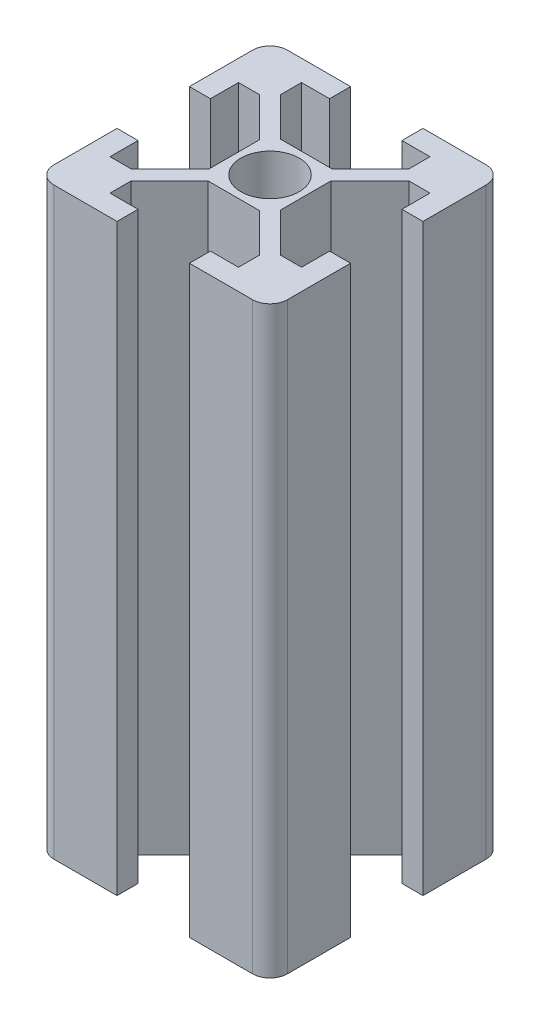
from build123d import *

# Parameters (mm, degrees)
SKETCH_1_R      = 2.5
EXTRUDE_1_DEPTH = 50


with BuildPart() as part:
    # 草图1 → 凸台-拉伸1 (new body)
    with BuildSketch(Plane(origin=(0, 0, 0), x_dir=(1, 0, 0), z_dir=(0, 1, 0))):
        with BuildLine():
            Line((-46.447412537, 7.805888715), (-48.247412537, 7.805888715))
            Line((-48.247412537, 7.805888715), (-48.247412537, 2.405888715))
            ThreePointArc((-48.247412537, 2.405888715), (-47.808072709, 1.345228544), (-46.747412537, 0.905888715))
            Line((-46.747412537, 0.905888715), (-41.347412537, 0.905888715))
            Line((-41.347412537, 0.905888715), (-41.347412537, 2.705888715))
            Line((-41.347412537, 2.705888715), (-43.747412537, 2.705888715))
            Line((-43.747412537, 2.705888715), (-43.747412537, 4.50883856))
            Line((-43.747412537, 4.50883856), (-40.450362382, 7.805888715))
            Line((-40.450362382, 7.805888715), (-36.044462693, 7.805888715))
            Line((-36.044462693, 7.805888715), (-32.747412537, 4.50883856))
            Line((-32.747412537, 4.50883856), (-32.747412537, 2.705888715))
            Line((-32.747412537, 2.705888715), (-35.147412537, 2.705888715))
            Line((-35.147412537, 2.705888715), (-35.147412537, 0.905888715))
            Line((-35.147412537, 0.905888715), (-29.747412537, 0.905888715))
            ThreePointArc((-29.747412537, 0.905888715), (-28.686752366, 1.345228544), (-28.247412537, 2.405888715))
            Line((-28.247412537, 2.405888715), (-28.247412537, 7.805888715))
            Line((-28.247412537, 7.805888715), (-30.047412537, 7.805888715))
            Line((-30.047412537, 7.805888715), (-30.047412537, 5.405888715))
            Line((-30.047412537, 5.405888715), (-31.850362382, 5.405888715))
            Line((-31.850362382, 5.405888715), (-35.193285517, 8.74881185))
            Line((-35.193285517, 8.74881185), (-35.193285517, 13.062965581))
            Line((-35.193285517, 13.062965581), (-31.850362382, 16.405888715))
            Line((-31.850362382, 16.405888715), (-30.047412537, 16.405888715))
            Line((-30.047412537, 16.405888715), (-30.047412537, 14.005888715))
            Line((-30.047412537, 14.005888715), (-28.247412537, 14.005888715))
            Line((-28.247412537, 14.005888715), (-28.247412537, 19.405888715))
            ThreePointArc((-28.247412537, 19.405888715), (-28.686752366, 20.466548887), (-29.747412537, 20.905888715))
            Line((-29.747412537, 20.905888715), (-35.147412537, 20.905888715))
            Line((-35.147412537, 20.905888715), (-35.147412537, 19.105888715))
            Line((-35.147412537, 19.105888715), (-32.747412537, 19.105888715))
            Line((-32.747412537, 19.105888715), (-32.747412537, 17.302938871))
            Line((-32.747412537, 17.302938871), (-36.044462693, 14.005888715))
            Line((-36.044462693, 14.005888715), (-40.450362382, 14.005888715))
            Line((-40.450362382, 14.005888715), (-43.747412537, 17.302938871))
            Line((-43.747412537, 17.302938871), (-43.747412537, 19.105888715))
            Line((-43.747412537, 19.105888715), (-41.347412537, 19.105888715))
            Line((-41.347412537, 19.105888715), (-41.347412537, 20.905888715))
            Line((-41.347412537, 20.905888715), (-46.747412537, 20.905888715))
            ThreePointArc((-46.747412537, 20.905888715), (-47.808072709, 20.466548887), (-48.247412537, 19.405888715))
            Line((-48.247412537, 19.405888715), (-48.247412537, 14.005888715))
            Line((-48.247412537, 14.005888715), (-46.447412537, 14.005888715))
            Line((-46.447412537, 14.005888715), (-46.447412537, 16.405888715))
            Line((-46.447412537, 16.405888715), (-44.644462693, 16.405888715))
            Line((-44.644462693, 16.405888715), (-41.301539558, 13.062965581))
            Line((-41.301539558, 13.062965581), (-41.301539558, 8.74881185))
            Line((-41.301539558, 8.74881185), (-44.644462693, 5.405888715))
            Line((-44.644462693, 5.405888715), (-46.447412537, 5.405888715))
            Line((-46.447412537, 5.405888715), (-46.447412537, 7.805888715))
        make_face()
        with Locations(Location((-38.247412537, 10.905888715, 0), (0, 0, 270))):
            Circle(SKETCH_1_R, mode=Mode.SUBTRACT)
    extrude(amount=EXTRUDE_1_DEPTH)


solid = part.part
